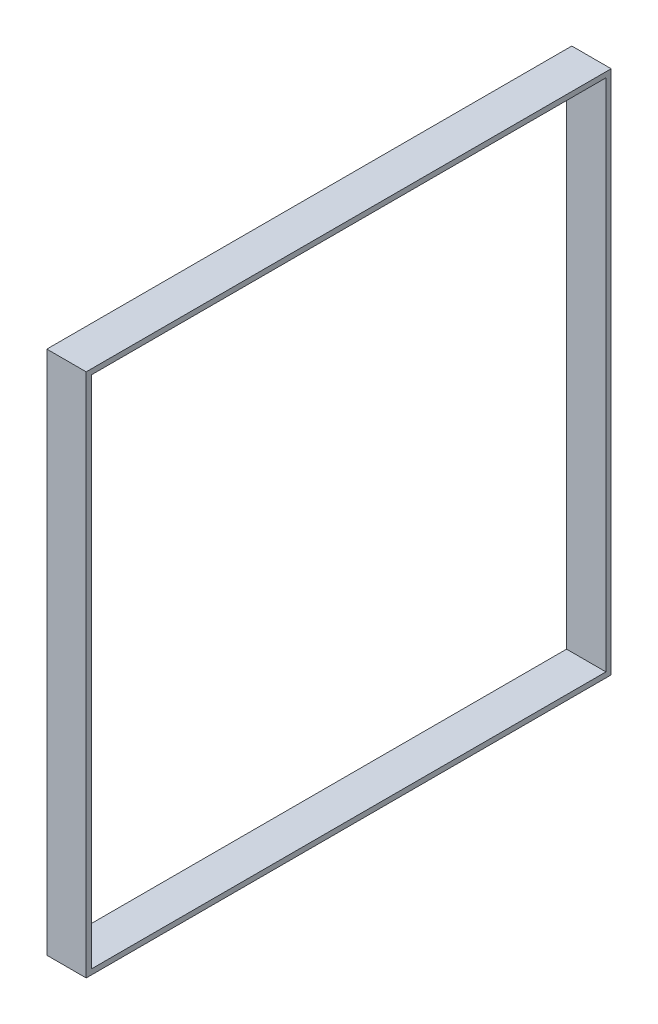
from build123d import *

# Parameters (mm, degrees)
SKETCH1_W           = 2000
SKETCH1_H           = 2000
SKETCH1_W_2         = 1960
SKETCH1_H_2         = 1960
EXTRUDE_THIN1_DEPTH = 150


with BuildPart() as part:
    # Sketch1 → Extrude-Thin1 (new body)
    with BuildSketch(Plane(origin=(0, 0, 0), x_dir=(0, 0, -1), z_dir=(1, 0, 0))):
        Rectangle(SKETCH1_W, SKETCH1_H)
        Rectangle(SKETCH1_W_2, SKETCH1_H_2, mode=Mode.SUBTRACT)
    extrude(amount=EXTRUDE_THIN1_DEPTH)


solid = part.part
